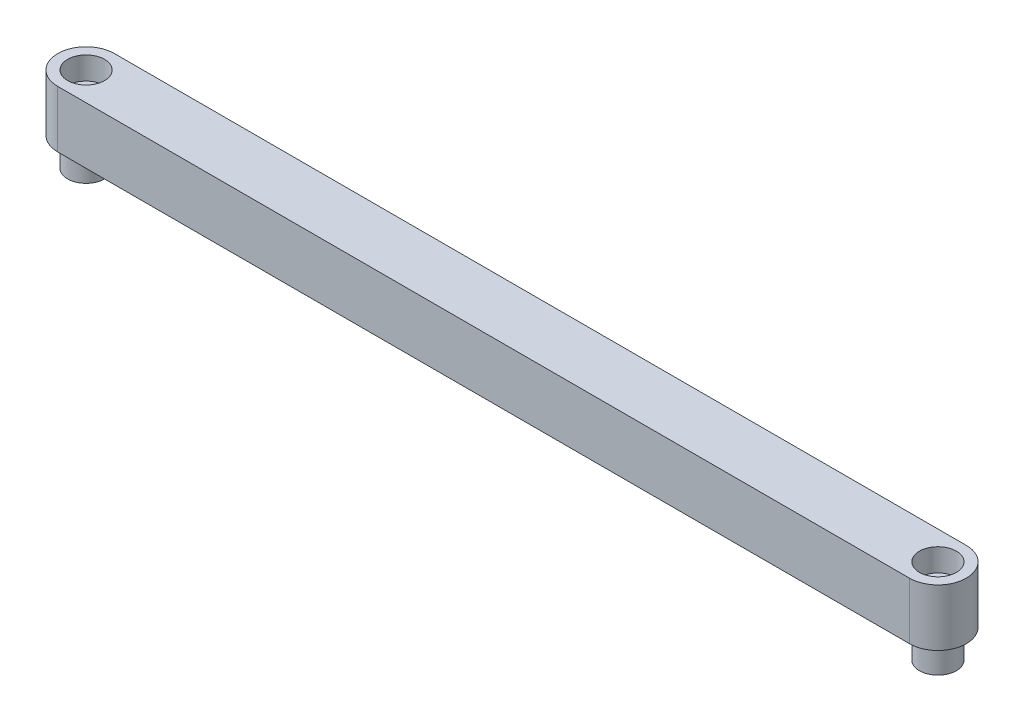
from build123d import *

# Parameters (mm, degrees)
BOSS_EXTRUDE1_DEPTH = 15
SKETCH2_R           = 9.75
CUT_EXTRUDE2_DEPTH  = 241.935676063
BOSS_EXTRUDE2_START = -30
SKETCH2_3_R         = 9.75
BOSS_EXTRUDE2_DEPTH = 30
SKETCH2_4_R         = 9.75
BOSS_EXTRUDE3_DEPTH = 3


with BuildPart() as part:
    # Sketch1 → Boss-Extrude1 (new, symmetric)
    with BuildSketch(Plane(origin=(0, 0, 0), x_dir=(1, 0, 0), z_dir=(0, 1, 0))):
        with BuildLine():
            Line((-225, 15), (225, 15))
            ThreePointArc((225, 15), (240, 0), (225, -15))
            Line((225, -15), (-225, -15))
            ThreePointArc((-225, -15), (-240, 0), (-225, 15))
        make_face()
    extrude(amount=BOSS_EXTRUDE1_DEPTH, both=True)

    # Sketch2 → Cut-Extrude2 (cut, through all)
    with BuildSketch(Plane(origin=(0, 0, 0), x_dir=(1, 0, 0), z_dir=(0, 1, 0))):
        with Locations((-225, 0)):
            Circle(SKETCH2_R)
        with Locations((225, 0)):
            Circle(SKETCH2_R)
    extrude(amount=CUT_EXTRUDE2_DEPTH, mode=Mode.SUBTRACT)

    # Sketch2<3> → Boss-Extrude2 (add)
    with BuildSketch(Plane(origin=(0, 0, 0), x_dir=(1, 0, 0), z_dir=(0, 1, 0)).offset(BOSS_EXTRUDE2_START)):
        with Locations((-225, 0)):
            Circle(SKETCH2_3_R)
        with Locations((225, 0)):
            Circle(SKETCH2_3_R)
    extrude(amount=BOSS_EXTRUDE2_DEPTH)

    # Sketch2<4> → Boss-Extrude3 (add)
    with BuildSketch(Plane(origin=(0, 0, 0), x_dir=(1, 0, 0), z_dir=(0, 1, 0))):
        with Locations((-225, 0)):
            Circle(SKETCH2_4_R)
        with Locations((225, 0)):
            Circle(SKETCH2_4_R)
    extrude(amount=BOSS_EXTRUDE3_DEPTH)


solid = part.part
